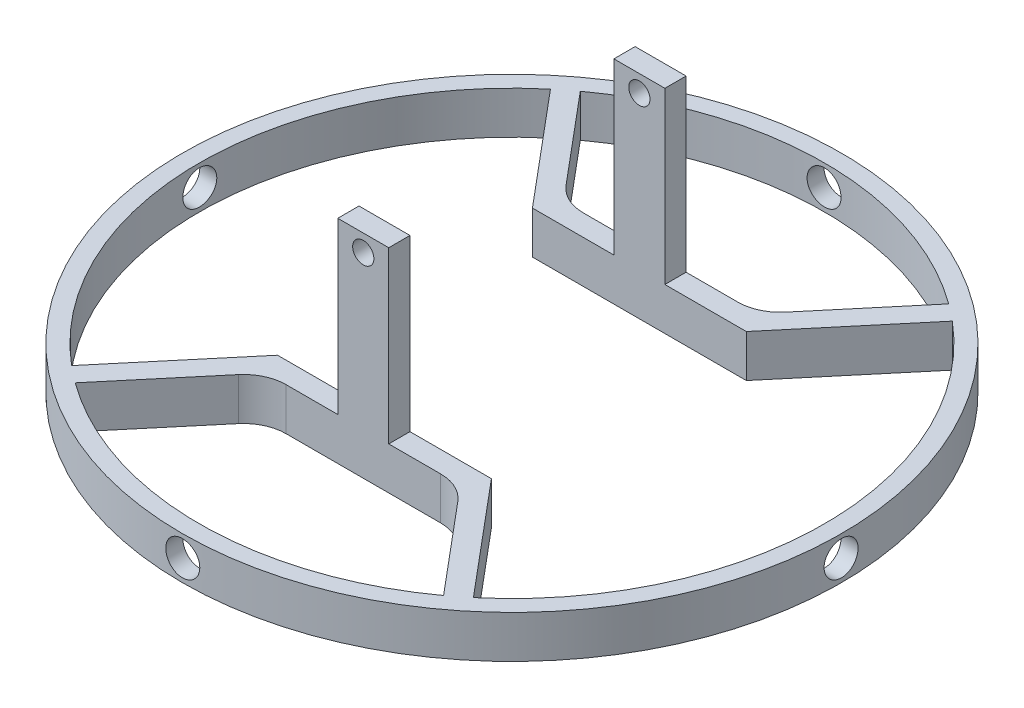
from build123d import *

# Parameters (mm, degrees)
CROQUIS2_R                 = 38.79
SALIENTE_EXTRUIR1_DEPTH    = 5
CROQUIS4_W                 = 6
CROQUIS4_H                 = 25
SALIENTE_EXTRUIR3_DEPTH    = 2.5
CORTAR_EXTRUIR1_DEPTH      = 73.788929103
CORTAR_EXTRUIR1_DEPTH_BACK = 73.788929103
CROQUIS5_R                 = 1.25
REDONDEO1_R                = 5
CORTAR_EXTRUIR2_START      = 50
CROQUIS6_R                 = 2
CORTAR_EXTRUIR2_DEPTH      = 17
MATRIZC1_COUNT             = 4


with BuildPart() as part:
    # Croquis2 → Saliente-Extruir1 (new body)
    with BuildSketch(Plane(origin=(0, 0, 0), x_dir=(1, 0, 0), z_dir=(0, 1, 0))):
        with Locations(Location((0, 0, 0), (0, 0, 270))):
            Circle(CROQUIS2_R)
        with BuildLine():
            Line((-12.586494468, 15), (12.586494468, 15))
            Line((12.586494468, 15), (23.64815616, 28.182775062))
            ThreePointArc((23.64815616, 28.182775062), (36.79, 0), (23.64815616, -28.182775062))
            Line((23.64815616, -28.182775062), (12.586494468, -15))
            Line((12.586494468, -15), (-12.586494468, -15))
            Line((-12.586494468, -15), (-23.64815616, -28.182775062))
            ThreePointArc((-23.64815616, -28.182775062), (-36.79, 0), (-23.64815616, 28.182775062))
            Line((-23.64815616, 28.182775062), (-12.586494468, 15))
        make_face(mode=Mode.SUBTRACT)
        with BuildLine():
            Line((-11.420725322, 17.5), (-21.678382494, 29.724599786))
            ThreePointArc((-21.678382494, 29.724599786), (0, 36.79), (21.678382494, 29.724599786))
            Line((21.678382494, 29.724599786), (11.420725322, 17.5))
            Line((11.420725322, 17.5), (-11.420725322, 17.5))
        make_face(mode=Mode.SUBTRACT)
        with BuildLine():
            ThreePointArc((21.678382494, -29.724599786), (0, -36.79), (-21.678382494, -29.724599786))
            Line((-21.678382494, -29.724599786), (-11.420725322, -17.5))
            Line((-11.420725322, -17.5), (11.420725322, -17.5))
            Line((11.420725322, -17.5), (21.678382494, -29.724599786))
        make_face(mode=Mode.SUBTRACT)
    extrude(amount=SALIENTE_EXTRUIR1_DEPTH)

    # Croquis4 → Saliente-Extruir3 (add)
    with BuildSketch(Plane.XY.offset(15)):
        with Locations((0, 12.5)):
            Rectangle(CROQUIS4_W, CROQUIS4_H)
    saliente_extruir3 = extrude(amount=SALIENTE_EXTRUIR3_DEPTH)

    # Simetría1: Saliente-Extruir3 across plane
    add(saliente_extruir3.mirror(Plane.XY))

    # Croquis5 → Cortar-Extruir1 (cut, two sides: drawn at the far end of the back side and taken through both)
    with BuildSketch(Plane(origin=(0, 0, -17.5), x_dir=(-1, 0, 0), z_dir=(0, 0, -1)).offset(-CORTAR_EXTRUIR1_DEPTH_BACK)):
        with Locations(Location((0, 23, 0), (0, 0, 180))):
            Circle(CROQUIS5_R)
    extrude(amount=CORTAR_EXTRUIR1_DEPTH + CORTAR_EXTRUIR1_DEPTH_BACK, mode=Mode.SUBTRACT)

    # Redondeo1
    redondeo1_edges = [part.edges().sort_by_distance(p)[0] for p in [
        (-11.420725322, 2.5, -17.5),
        (11.420725322, 2.5, -17.5),
        (11.420725322, 2.5, 17.5),
        (-11.420725322, 2.5, 17.5),
    ]]
    fillet(redondeo1_edges, radius=REDONDEO1_R)

    # Croquis6 → Cortar-Extruir2 (cut)
    with BuildSketch(Plane.XY.offset(CORTAR_EXTRUIR2_START)):
        with Locations((0, 2.5)):
            Circle(CROQUIS6_R)
    cortar_extruir2 = extrude(amount=-CORTAR_EXTRUIR2_DEPTH, mode=Mode.SUBTRACT)

    # MatrizC1: Cortar-Extruir2 ×4 about axis
    matrizc1_axis = Axis((0, 0, 0), (0, -1, 0))
    for i in range(1, MATRIZC1_COUNT):
        add(cortar_extruir2.rotate(matrizc1_axis, i * 360 / MATRIZC1_COUNT), mode=Mode.SUBTRACT)


solid = part.part
